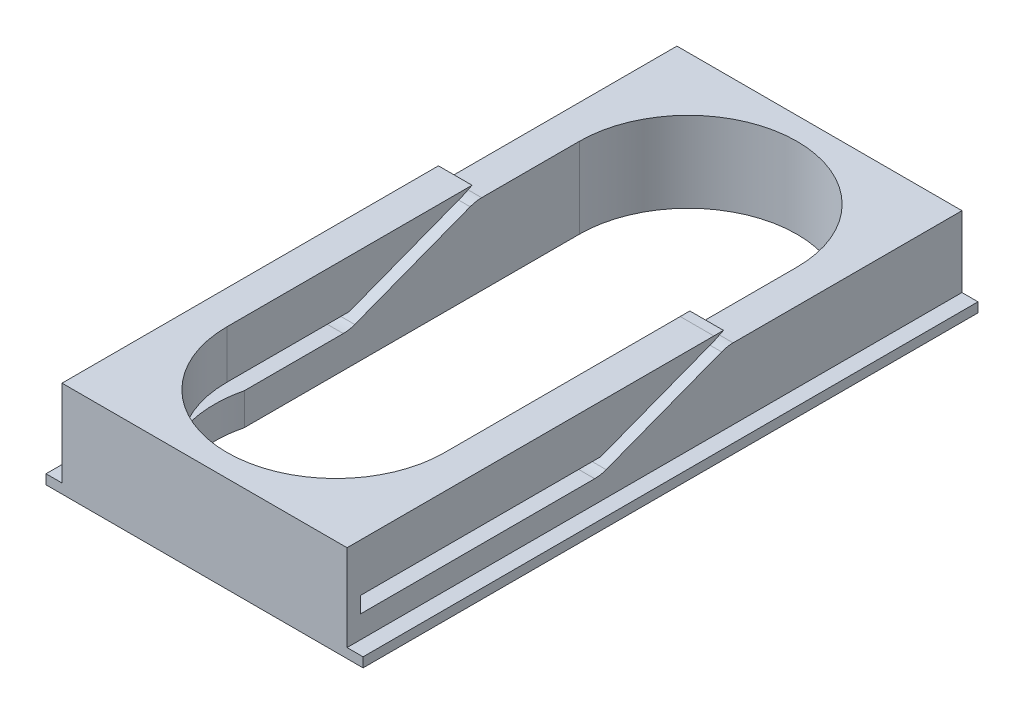
from build123d import *

# Parameters (mm, degrees)
SKETCH1_W                = 89
SKETCH1_H                = 192
BOSS_EXTRUDE1_DEPTH      = 30
SKETCH2_R                = 34.99943994
CUT_EXTRUDE1_DEPTH       = 10
SKETCH3_W                = 75
SKETCH3_H                = 5
CUT_EXTRUDE2_DEPTH       = 102
CUT_EXTRUDE4_DEPTH       = 102
SKETCH6_W                = 10.5
SKETCH6_H                = 4
CUT_EXTRUDE7_DEPTH       = 8
BOSS_EXTRUDE2_DEPTH      = 10.5
CUT_EXTRUDE8_DEPTH       = 20.767757578
BOSS_EXTRUDE3_DEPTH      = 10.5
CUT_EXTRUDE9_DEPTH       = 22.812544275
BOSS_EXTRUDE6_DEPTH      = 10.5
BOSS_EXTRUDE7_DEPTH      = 10.5
FILLET1_R                = 10
FILLET2_R                = 10
FILLET3_R                = 10
FILLET4_R                = 10
CUT_EXTRUDE11_DEPTH      = 99
SKETCH15_W               = 7.554212703
SKETCH15_H               = 3.259234926
CUT_EXTRUDE12_DEPTH      = 99
FILLET5_R                = 10
BOSS_EXTRUDE8_DEPTH      = 0.001
BOSS_EXTRUDE8_DEPTH_BACK = 3
SKETCH16_W               = 5
SKETCH16_H               = 192


with BuildPart() as part:
    # Sketch1 → Boss-Extrude1 (new body)
    with BuildSketch(Plane(origin=(0, 0, 0), x_dir=(1, 0, 0), z_dir=(0, 1, 0))):
        with Locations((-10.5, 20.043668932)):
            Rectangle(SKETCH1_W, SKETCH1_H)
        with BuildLine():
            Line((-44.5, -34.956331068), (-44.5, 75.043668932))
            ThreePointArc((-44.5, 75.043668932), (-10.5, 109.043668932), (23.5, 75.043668932))
            Line((23.5, 75.043668932), (23.5, -34.956331068))
            ThreePointArc((23.5, -34.956331068), (-10.5, -68.956331068), (-44.5, -34.956331068))
        make_face(mode=Mode.SUBTRACT)
    extrude(amount=BOSS_EXTRUDE1_DEPTH)

    # Sketch2 → Cut-Extrude1 (cut)
    with BuildSketch(Plane.XZ):
        with Locations((-10.5, 37.838844027)):
            Circle(SKETCH2_R)
    extrude(amount=-CUT_EXTRUDE1_DEPTH, mode=Mode.SUBTRACT)

    # Sketch3 → Cut-Extrude2 (cut)
    with BuildSketch(Plane(origin=(34, 0, 0), x_dir=(0, 0, -1), z_dir=(1, 0, 0))):
        with Locations((-34.286288065, 12.5)):
            Rectangle(SKETCH3_W, SKETCH3_H)
    extrude(amount=-CUT_EXTRUDE2_DEPTH, mode=Mode.SUBTRACT)

    # Sketch4 → Cut-Extrude4 (cut)
    with BuildSketch(Plane.ZY.offset(55)):
        Polygon((-40.970715348, 29.469395922), (-41.211628541, 24.561719678), (-3.213711935, 10), (-3.213711935, 15), align=None)
    extrude(amount=-CUT_EXTRUDE4_DEPTH, mode=Mode.SUBTRACT)

    # Sketch6 → Cut-Extrude7 (cut)
    with BuildSketch(Plane(origin=(0, 30, 0), x_dir=(1, 0, 0), z_dir=(0, 1, 0))):
        with Locations((-49.75, 40.570603007)):
            Rectangle(SKETCH6_W, SKETCH6_H)
        with Locations((28.75, 40.570603007)):
            Rectangle(SKETCH6_W, SKETCH6_H)
    extrude(amount=-CUT_EXTRUDE7_DEPTH, mode=Mode.SUBTRACT)

    # Sketch7 → Boss-Extrude2 (add)
    with BuildSketch(Plane.ZY.offset(55)):
        Polygon((-38.570603007, 23.549614886), (-42.570603007, 25.082511526), (-42.570603007, 22), (-38.570603007, 22), align=None)
    extrude(amount=-BOSS_EXTRUDE2_DEPTH)

    # Sketch8 → Cut-Extrude8 (cut)
    with BuildSketch(Plane.ZY.offset(55)):
        Polygon((-42.570603007, 25.082511526), (-55.402488324, 30), (-42.570603007, 30), align=None)
    extrude(amount=-CUT_EXTRUDE8_DEPTH, mode=Mode.SUBTRACT)

    # Sketch9 → Boss-Extrude3 (add)
    with BuildSketch(Plane(origin=(34, 0, 0), x_dir=(0, 0, -1), z_dir=(1, 0, 0))):
        Polygon((38.570603007, 23.549614886), (42.570603007, 25.082511526), (42.570603007, 22), (38.570603007, 22), align=None)
    extrude(amount=-BOSS_EXTRUDE3_DEPTH)

    # Sketch10 → Cut-Extrude9 (cut)
    with BuildSketch(Plane(origin=(34, 0, 0), x_dir=(0, 0, -1), z_dir=(1, 0, 0))):
        Polygon((42.570603007, 25.082511526), (55.402488324, 30), (42.570603007, 30), align=None)
    extrude(amount=-CUT_EXTRUDE9_DEPTH, mode=Mode.SUBTRACT)

    # Sketch12 → Boss-Extrude6 (add)
    with BuildSketch(Plane.ZY.offset(55)):
        Polygon((-38.570603007, 30), (-41.570603007, 30), (-38.570603007, 28.549614886), align=None)
    extrude(amount=-BOSS_EXTRUDE6_DEPTH)

    # Sketch11 → Boss-Extrude7 (add)
    with BuildSketch(Plane(origin=(34, 0, 0), x_dir=(0, 0, -1), z_dir=(1, 0, 0))):
        Polygon((38.570603007, 28.549614886), (41.570603007, 30.007074027), (38.570603007, 30), align=None)
    extrude(amount=-BOSS_EXTRUDE7_DEPTH)

    # Fillet1
    fillet1_edges = [part.edges().sort_by_distance(p)[0] for p in [
        (-49.75, 30, -55.402488324),
    ]]
    fillet(fillet1_edges, radius=FILLET1_R)

    # Fillet2
    fillet2_edges = [part.edges().sort_by_distance(p)[0] for p in [
        (28.75, 30, -55.402488324),
    ]]
    fillet(fillet2_edges, radius=FILLET2_R)

    # Fillet3
    fillet3_edges = [part.edges().sort_by_distance(p)[0] for p in [
        (-49.75, 10, -3.213711935),
    ]]
    fillet(fillet3_edges, radius=FILLET3_R)

    # Fillet4
    fillet4_edges = [part.edges().sort_by_distance(p)[0] for p in [
        (28.75, 10, -3.213711935),
    ]]
    fillet(fillet4_edges, radius=FILLET4_R)

    # Sketch14 → Cut-Extrude11 (cut)
    with BuildSketch(Plane(origin=(34, 0, 0), x_dir=(0, 0, -1), z_dir=(1, 0, 0))):
        Polygon((42.717415751, 25.138773717), (116.043668932, 25.138773717), (116.043668932, 30), (57.252994033, 30), (53.674522762, 29.337801849), align=None)
    extrude(amount=-CUT_EXTRUDE11_DEPTH, mode=Mode.SUBTRACT)


with BuildPart() as cut_extrude11_piece_1:
    # of the separate pieces the step leaves, piece 1, a body of its own (cut_extrude11_pieces)
    add(part.part.solids().sort_by_distance((23.5, 25.138773717, -42.717415751))[0])

    # Fillet5
    fillet5_edges = [cut_extrude11_piece_1.edges().sort_by_distance(p)[0] for p in [
        (-49.75, 25.138773717, -42.717415751),
        (28.75, 25.138773717, -42.717415751),
    ]]
    fillet(fillet5_edges, radius=FILLET5_R)

    # Sketch16 → Boss-Extrude8 (add, two sides: drawn at the far end of the back side and taken through both)
    with BuildSketch(Plane(origin=(0, 0, 0), x_dir=(-1, 0, 0), z_dir=(0, -1, 0)).offset(-BOSS_EXTRUDE8_DEPTH_BACK)):
        with Locations((-36.5, 20.043668932)):
            Rectangle(SKETCH16_W, SKETCH16_H)
        with Locations((57.5, 20.043668932)):
            Rectangle(SKETCH16_W, SKETCH16_H)
    extrude(amount=BOSS_EXTRUDE8_DEPTH + BOSS_EXTRUDE8_DEPTH_BACK)


with BuildPart() as cut_extrude11_piece_2:
    # of the separate pieces the step leaves, piece 2, a body of its own (cut_extrude11_pieces)
    add(part.part.solids().sort_by_distance((23.5, 30, -57.252994033))[0])


with BuildPart() as cut_extrude11_piece_3:
    # of the separate pieces the step leaves, piece 3, a body of its own (cut_extrude11_pieces)
    add(part.part.solids().sort_by_distance((-55, 30, -57.252994033))[0])


with BuildPart() as cut_extrude12_tool:
    # Sketch15 → Cut-Extrude12 (new body)
    with BuildSketch(Plane(origin=(34, 0, 0), x_dir=(0, 0, -1), z_dir=(1, 0, 0))):
        with Locations((54.846987071, 29.864387296)):
            Rectangle(SKETCH15_W, SKETCH15_H)
    extrude(amount=-CUT_EXTRUDE12_DEPTH)


with BuildPart() as cut_extrude11_piece_2_1:
    add(cut_extrude11_piece_2.part)

    # Cut-Extrude12: cut by cut_extrude12_tool
    add(cut_extrude12_tool.part, mode=Mode.SUBTRACT)


with BuildPart() as cut_extrude11_piece_3_1:
    add(cut_extrude11_piece_3.part)

    # Cut-Extrude12: cut by cut_extrude12_tool
    add(cut_extrude12_tool.part, mode=Mode.SUBTRACT)


solid = cut_extrude11_piece_1.part
